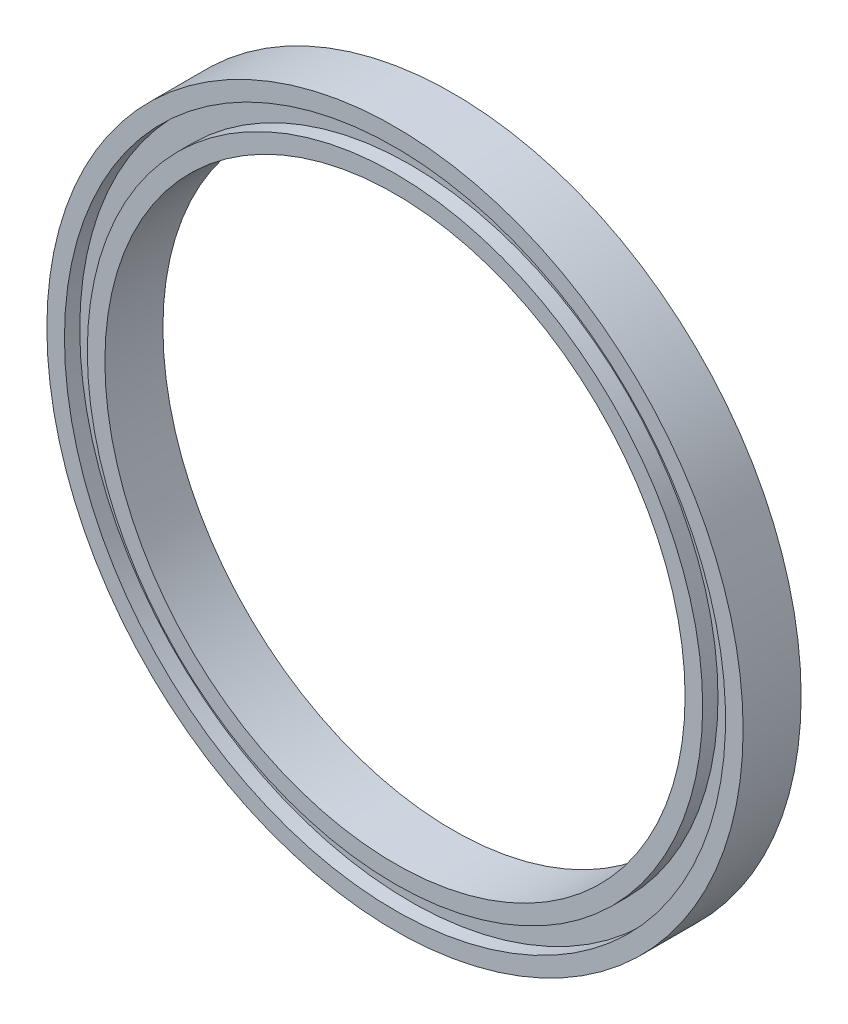
from build123d import *


with BuildPart() as part:
    # 草图1 → 旋转1 (revolve)
    with BuildSketch(Plane(origin=(0, 0, 0), x_dir=(0, 0, -1), z_dir=(1, 0, 0)), mode=Mode.PRIVATE) as revolve_1_sk:
        Polygon((-3.175, 38.1), (3.175, 38.1), (3.175, 36.175), (1.5, 36.175), (1.5, 33.675), (3.175, 33.675), (3.175, 31.75), (-3.175, 31.75), (-3.175, 33.675), (-1.5, 33.675), (-1.5, 36.175), (-3.175, 36.175), align=None)
    revolve(revolve_1_sk.sketch.rotate(Axis((0, 0, 0), (0, 0, 1)), 90), axis=Axis((0, 0, 0), (0, 0, 1)))


solid = part.part
